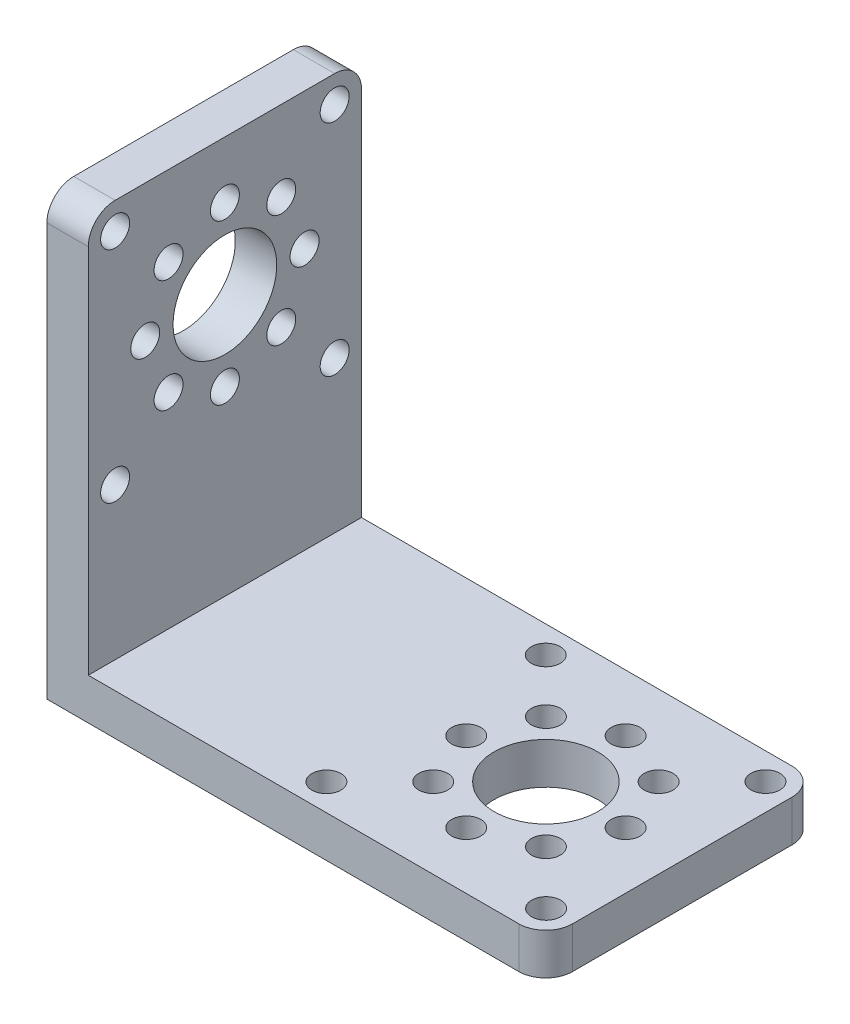
from build123d import *

# Parameters (mm, degrees)
SKETCH1_W                = 61.214
SKETCH1_H                = 53.9115
BOSS_EXTRUDE1_DEPTH      = 33.528
SKETCH2_W                = 56.134
SKETCH2_H                = 48.8315
CUT_EXTRUDE1_DEPTH       = 72.619133095
HOLE1_D                  = 12.7254
HOLE1_DEPTH              = 53.9115
M3_CLEARANCE_HOLE1_D     = 3.556
M3_CLEARANCE_HOLE1_DEPTH = 53.9115
HOLE2_D                  = 12.7254
HOLE2_DEPTH              = 61.214
M3_CLEARANCE_HOLE2_D     = 3.556
M3_CLEARANCE_HOLE2_DEPTH = 61.214
FILLET1_R                = 3.29438


with BuildPart() as part:
    # Sketch1 → Boss-Extrude1 (new body)
    with BuildSketch(Plane(origin=(0, 0, -16.764), x_dir=(-1, 0, 0), z_dir=(0, 0, -1))):
        with Locations((2.54, 26.95575)):
            Rectangle(SKETCH1_W, SKETCH1_H)
    extrude(amount=-BOSS_EXTRUDE1_DEPTH)

    # Sketch2 → Cut-Extrude1 (cut, through all)
    with BuildSketch(Plane.XY.offset(16.764)):
        with Locations((0, 29.49575)):
            Rectangle(SKETCH2_W, SKETCH2_H)
    extrude(amount=-CUT_EXTRUDE1_DEPTH, mode=Mode.SUBTRACT)

    # Hole1
    with Locations(Plane(origin=(0, 0, 0), x_dir=(-1, 0, 0), z_dir=(0, -1, 0))):
        with Locations((-11.33094, 0)):
            Hole(HOLE1_D / 2, depth=HOLE1_DEPTH)

    # M3 Clearance Hole1
    with Locations(Plane(origin=(0, 0, 0), x_dir=(-1, 0, 0), z_dir=(0, -1, 0))):
        with Locations((-4.416142787, -6.914797213), (-1.55194, 0), (-4.416142787, 6.914797213), (-11.33094, 9.779), (-18.245737213, 6.914797213), (-21.10994, 0), (-18.245737213, -6.914797213), (-11.33094, -9.779), (-24.790084818, 13.481614175), (2.150674175, 13.459144818), (2.128204818, -13.481614175), (-24.812554175, -13.459144818)):
            Hole(M3_CLEARANCE_HOLE1_D / 2, depth=M3_CLEARANCE_HOLE1_DEPTH)

    # Hole2
    with Locations(Plane.ZY.offset(33.147)):
        with Locations((0, 37.1475)):
            Hole(HOLE2_D / 2, depth=HOLE2_DEPTH)

    # M3 Clearance Hole2
    with Locations(Plane.ZY.offset(33.147)):
        with Locations((13.470384182, 23.677115818), (-13.470384182, 23.677115818), (-13.470384182, 50.617884182), (13.470384182, 50.617884182), (6.914797213, 30.232702787), (0, 27.3685), (-6.914797213, 30.232702787), (-9.779, 37.1475), (-6.914797213, 44.062297213), (0, 46.9265), (6.914797213, 44.062297213), (9.779, 37.1475)):
            Hole(M3_CLEARANCE_HOLE2_D / 2, depth=M3_CLEARANCE_HOLE2_DEPTH)

    # Fillet1
    fillet1_edges = [part.edges().sort_by_distance(p)[0] for p in [
        (28.067, 2.54, -16.764),
        (28.067, 2.54, 16.764),
        (-30.607, 53.9115, -16.764),
        (-30.607, 53.9115, 16.764),
    ]]
    fillet(fillet1_edges, radius=FILLET1_R)


solid = part.part
